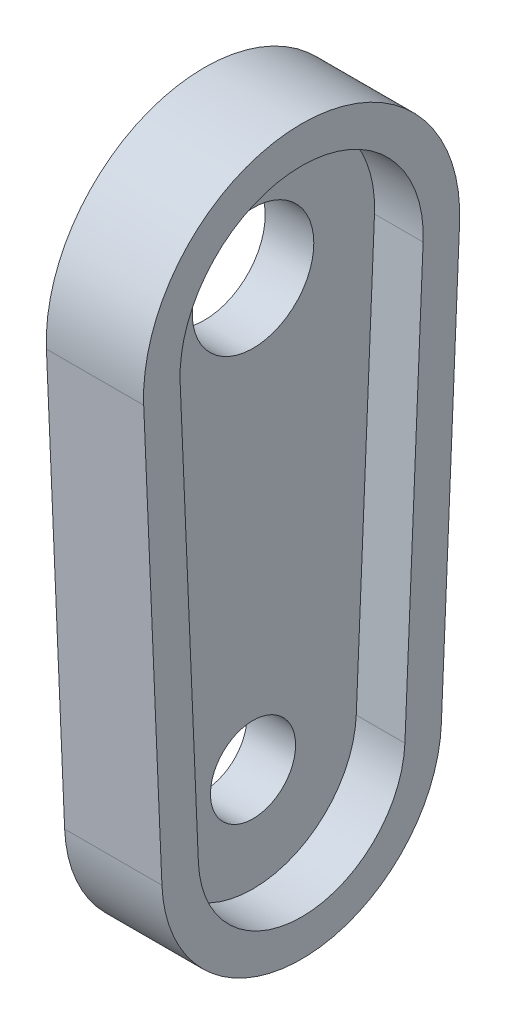
from build123d import *

# Parameters (mm, degrees)
EXTRUDE_1_DEPTH     = 4
EXTRUDE_2_DEPTH     = 8
CUT_EXTRUDE_1_DEPTH = 4


with BuildPart() as part:
    # Эскиз1 → Бобышка-Вытянуть1 (new body)
    with BuildSketch(Plane(origin=(0, 0, 0), x_dir=(0, 0, -1), z_dir=(1, 0, 0))):
        with BuildLine():
            Line((-7.553494652, -10.580393119), (-7.992649685, -0.342857143))
            ThreePointArc((-7.992649685, -0.342857143), (-0.171467962, 7.99816221), (8, 0))
            ThreePointArc((8, 0), (7.99816221, -0.171467962), (7.992649685, -0.342857143))
            Line((7.992649685, -0.342857143), (7.553494652, -10.580393119))
            ThreePointArc((7.553494652, -10.580393119), (11.428263628, -6.196352996), (12.988055737, -0.557142857))
            ThreePointArc((12.988055737, -0.557142857), (12.997013591, -0.278635438), (13, 0))
            ThreePointArc((13, 0), (-0.278635438, 12.997013591), (-12.988055737, -0.557142857))
            ThreePointArc((-12.988055737, -0.557142857), (-11.428263628, -6.196352996), (-7.553494652, -10.580393119))
        make_face()
        with BuildLine():
            Line((-4.727763281, -6.453545875), (-4.995406053, -0.214285714))
            ThreePointArc((-4.995406053, -0.214285714), (-0.107167476, 4.998851381), (5, 0))
            ThreePointArc((5, 0), (4.998851381, -0.107167476), (4.995406053, -0.214285714))
            Line((4.995406053, -0.214285714), (4.727763281, -6.453545875))
            ThreePointArc((4.727763281, -6.453545875), (7.056015568, -3.769966087), (7.992649685, -0.342857143))
            ThreePointArc((7.992649685, -0.342857143), (7.99816221, -0.171467962), (8, 0))
            ThreePointArc((8, 0), (-0.171467962, 7.99816221), (-7.992649685, -0.342857143))
            ThreePointArc((-7.992649685, -0.342857143), (-7.056015568, -3.769966087), (-4.727763281, -6.453545875))
        make_face()
        with BuildLine():
            Line((0, -8), (0, -5))
            ThreePointArc((0, -5), (-3.458942861, -3.610500559), (-4.995406053, -0.214285714))
            Line((-4.995406053, -0.214285714), (-4.727763281, -6.453545875))
            ThreePointArc((-4.727763281, -6.453545875), (-2.487130174, -7.603563868), (0, -8))
        make_face()
        with BuildLine():
            ThreePointArc((4.995406053, -0.214285714), (3.458942861, -3.610500559), (0, -5))
            Line((0, -5), (0, -8))
            ThreePointArc((0, -8), (2.487130174, -7.603563868), (4.727763281, -6.453545875))
            Line((4.727763281, -6.453545875), (4.995406053, -0.214285714))
        make_face()
        with BuildLine():
            ThreePointArc((4.727763281, -6.453545875), (2.487130174, -7.603563868), (0, -8))
            Line((0, -8), (0, -13))
            ThreePointArc((0, -13), (2.275699548, -12.799265274), (4.481120339, -12.203260241))
            Line((4.481120339, -12.203260241), (4.727763281, -6.453545875))
        make_face()
        with BuildLine():
            ThreePointArc((7.992649685, -0.342857143), (7.056015568, -3.769966087), (4.727763281, -6.453545875))
            Line((4.727763281, -6.453545875), (4.481120339, -12.203260241))
            ThreePointArc((4.481120339, -12.203260241), (6.071771893, -11.494937411), (7.553494652, -10.580393119))
            Line((7.553494652, -10.580393119), (7.992649685, -0.342857143))
        make_face()
        with BuildLine():
            Line((0, -13), (0, -8))
            ThreePointArc((0, -8), (-2.487130174, -7.603563868), (-4.727763281, -6.453545875))
            Line((-4.727763281, -6.453545875), (-4.481120339, -12.203260241))
            ThreePointArc((-4.481120339, -12.203260241), (-2.275699548, -12.799265274), (0, -13))
        make_face()
        with BuildLine():
            Line((-4.481120339, -12.203260241), (-4.727763281, -6.453545875))
            ThreePointArc((-4.727763281, -6.453545875), (-7.056015568, -3.769966087), (-7.992649685, -0.342857143))
            Line((-7.992649685, -0.342857143), (-7.553494652, -10.580393119))
            ThreePointArc((-7.553494652, -10.580393119), (-6.071771893, -11.494937411), (-4.481120339, -12.203260241))
        make_face()
        with BuildLine():
            Line((-3.966260715, -24.205613684), (-4.481120339, -12.203260241))
            ThreePointArc((-4.481120339, -12.203260241), (-6.071771893, -11.494937411), (-7.553494652, -10.580393119))
            Line((-7.553494652, -10.580393119), (-6.900606425, -25.80045485))
            ThreePointArc((-6.900606425, -25.80045485), (-5.491637274, -24.895945366), (-3.966260715, -24.205613684))
        make_face()
        with BuildLine():
            Line((-6.900606425, -25.80045485), (-7.553494652, -10.580393119))
            ThreePointArc((-7.553494652, -10.580393119), (-11.428263628, -6.196352996), (-12.988055737, -0.557142857))
            Line((-12.988055737, -0.557142857), (-11.489433922, -35.492857143))
            ThreePointArc((-11.489433922, -35.492857143), (-10.393943503, -30.07903074), (-6.900606425, -25.80045485))
        make_face()
        with BuildLine():
            Line((0, -23.5), (0, -13))
            ThreePointArc((0, -13), (-2.275699548, -12.799265274), (-4.481120339, -12.203260241))
            Line((-4.481120339, -12.203260241), (-3.966260715, -24.205613684))
            ThreePointArc((-3.966260715, -24.205613684), (-2.014268771, -23.677777545), (0, -23.5))
        make_face()
        with BuildLine():
            ThreePointArc((4.481120339, -12.203260241), (2.275699548, -12.799265274), (0, -13))
            Line((0, -13), (0, -23.5))
            ThreePointArc((0, -23.5), (2.014268771, -23.677777545), (3.966260715, -24.205613684))
            Line((3.966260715, -24.205613684), (4.481120339, -12.203260241))
        make_face()
        with BuildLine():
            ThreePointArc((7.553494652, -10.580393119), (6.071771893, -11.494937411), (4.481120339, -12.203260241))
            Line((4.481120339, -12.203260241), (3.966260715, -24.205613684))
            ThreePointArc((3.966260715, -24.205613684), (5.491637274, -24.895945366), (6.900606425, -25.80045485))
            Line((6.900606425, -25.80045485), (7.553494652, -10.580393119))
        make_face()
        with BuildLine():
            ThreePointArc((12.988055737, -0.557142857), (11.428263628, -6.196352996), (7.553494652, -10.580393119))
            Line((7.553494652, -10.580393119), (6.900606425, -25.80045485))
            ThreePointArc((6.900606425, -25.80045485), (10.286082196, -29.857382665), (11.5, -35))
            ThreePointArc((11.5, -35), (11.497358177, -35.246485195), (11.489433922, -35.492857143))
            Line((11.489433922, -35.492857143), (12.988055737, -0.557142857))
        make_face()
        with BuildLine():
            ThreePointArc((11.5, -35), (10.286082196, -29.857382665), (6.900606425, -25.80045485))
            Line((6.900606425, -25.80045485), (6.494027869, -35.278571429))
            ThreePointArc((6.494027869, -35.278571429), (0, -41.5), (-6.494027869, -35.278571429))
            Line((-6.494027869, -35.278571429), (-6.900606425, -25.80045485))
            ThreePointArc((-6.900606425, -25.80045485), (-10.393943503, -30.07903074), (-11.489433922, -35.492857143))
            ThreePointArc((-11.489433922, -35.492857143), (0, -46.5), (11.489433922, -35.492857143))
            ThreePointArc((11.489433922, -35.492857143), (11.497358177, -35.246485195), (11.5, -35))
        make_face()
        with BuildLine():
            ThreePointArc((6.5, -35), (5.766493566, -32.000408036), (3.731522476, -29.677806842))
            Line((3.731522476, -29.677806842), (3.496784237, -35.15))
            ThreePointArc((3.496784237, -35.15), (0, -38.5), (-3.496784237, -35.15))
            Line((-3.496784237, -35.15), (-3.731522476, -29.677806842))
            ThreePointArc((-3.731522476, -29.677806842), (-5.829460606, -32.124693225), (-6.494027869, -35.278571429))
            ThreePointArc((-6.494027869, -35.278571429), (0, -41.5), (6.494027869, -35.278571429))
            ThreePointArc((6.494027869, -35.278571429), (6.498506796, -35.139317719), (6.5, -35))
        make_face()
        with BuildLine():
            Line((-3.731522476, -29.677806842), (-3.966260715, -24.205613684))
            ThreePointArc((-3.966260715, -24.205613684), (-5.491637274, -24.895945366), (-6.900606425, -25.80045485))
            Line((-6.900606425, -25.80045485), (-6.494027869, -35.278571429))
            ThreePointArc((-6.494027869, -35.278571429), (-5.829460606, -32.124693225), (-3.731522476, -29.677806842))
        make_face()
        with BuildLine():
            Line((0, -28.5), (0, -23.5))
            ThreePointArc((0, -23.5), (-2.014268771, -23.677777545), (-3.966260715, -24.205613684))
            Line((-3.966260715, -24.205613684), (-3.731522476, -29.677806842))
            ThreePointArc((-3.731522476, -29.677806842), (-1.956494885, -28.801441477), (0, -28.5))
        make_face()
        with BuildLine():
            ThreePointArc((3.966260715, -24.205613684), (2.014268771, -23.677777545), (0, -23.5))
            Line((0, -23.5), (0, -28.5))
            ThreePointArc((0, -28.5), (1.956494885, -28.801441477), (3.731522476, -29.677806842))
            Line((3.731522476, -29.677806842), (3.966260715, -24.205613684))
        make_face()
        with BuildLine():
            Line((0, -31.5), (0, -28.5))
            ThreePointArc((0, -28.5), (-1.956494885, -28.801441477), (-3.731522476, -29.677806842))
            Line((-3.731522476, -29.677806842), (-3.496784237, -35.15))
            ThreePointArc((-3.496784237, -35.15), (-2.527350391, -32.578739997), (0, -31.5))
        make_face()
        with BuildLine():
            ThreePointArc((3.731522476, -29.677806842), (1.956494885, -28.801441477), (0, -28.5))
            Line((0, -28.5), (0, -31.5))
            ThreePointArc((0, -31.5), (2.474873734, -32.525126266), (3.5, -35))
            ThreePointArc((3.5, -35), (3.499195967, -35.075017233), (3.496784237, -35.15))
            Line((3.496784237, -35.15), (3.731522476, -29.677806842))
        make_face()
        with BuildLine():
            ThreePointArc((6.900606425, -25.80045485), (5.491637274, -24.895945366), (3.966260715, -24.205613684))
            Line((3.966260715, -24.205613684), (3.731522476, -29.677806842))
            ThreePointArc((3.731522476, -29.677806842), (5.766493566, -32.000408036), (6.5, -35))
            ThreePointArc((6.5, -35), (6.498506796, -35.139317719), (6.494027869, -35.278571429))
            Line((6.494027869, -35.278571429), (6.900606425, -25.80045485))
        make_face()
    extrude(amount=EXTRUDE_1_DEPTH)

    # Эскиз1<5> → Бобышка-Вытянуть2 (add)
    with BuildSketch(Plane(origin=(0, 0, 0), x_dir=(0, 0, -1), z_dir=(1, 0, 0))):
        with BuildLine():
            Line((-6.900606425, -25.80045485), (-7.553494652, -10.580393119))
            ThreePointArc((-7.553494652, -10.580393119), (-11.428263628, -6.196352996), (-12.988055737, -0.557142857))
            Line((-12.988055737, -0.557142857), (-11.489433922, -35.492857143))
            ThreePointArc((-11.489433922, -35.492857143), (-10.393943503, -30.07903074), (-6.900606425, -25.80045485))
        make_face()
        with BuildLine():
            Line((-6.494027869, -35.278571429), (-6.900606425, -25.80045485))
            ThreePointArc((-6.900606425, -25.80045485), (-10.393943503, -30.07903074), (-11.489433922, -35.492857143))
            ThreePointArc((-11.489433922, -35.492857143), (0, -46.5), (11.489433922, -35.492857143))
            ThreePointArc((11.489433922, -35.492857143), (11.497358177, -35.246485195), (11.5, -35))
            ThreePointArc((11.5, -35), (10.286082196, -29.857382665), (6.900606425, -25.80045485))
            Line((6.900606425, -25.80045485), (6.494027869, -35.278571429))
            ThreePointArc((6.494027869, -35.278571429), (0, -41.5), (-6.494027869, -35.278571429))
        make_face()
        with BuildLine():
            ThreePointArc((12.988055737, -0.557142857), (11.428263628, -6.196352996), (7.553494652, -10.580393119))
            Line((7.553494652, -10.580393119), (6.900606425, -25.80045485))
            ThreePointArc((6.900606425, -25.80045485), (10.286082196, -29.857382665), (11.5, -35))
            ThreePointArc((11.5, -35), (11.497358177, -35.246485195), (11.489433922, -35.492857143))
            Line((11.489433922, -35.492857143), (12.988055737, -0.557142857))
        make_face()
        with BuildLine():
            Line((-7.553494652, -10.580393119), (-7.992649685, -0.342857143))
            ThreePointArc((-7.992649685, -0.342857143), (-0.171467962, 7.99816221), (8, 0))
            ThreePointArc((8, 0), (7.99816221, -0.171467962), (7.992649685, -0.342857143))
            Line((7.992649685, -0.342857143), (7.553494652, -10.580393119))
            ThreePointArc((7.553494652, -10.580393119), (11.428263628, -6.196352996), (12.988055737, -0.557142857))
            ThreePointArc((12.988055737, -0.557142857), (12.997013591, -0.278635438), (13, 0))
            ThreePointArc((13, 0), (-0.278635438, 12.997013591), (-12.988055737, -0.557142857))
            ThreePointArc((-12.988055737, -0.557142857), (-11.428263628, -6.196352996), (-7.553494652, -10.580393119))
        make_face()
    extrude(amount=EXTRUDE_2_DEPTH)

    # Эскиз2 → Вырез-Вытянуть1 (cut)
    with BuildSketch(Plane(origin=(8, 0, 0), x_dir=(0, 0, -1), z_dir=(1, 0, 0))):
        with BuildLine():
            Line((-9.990812106, -0.428571429), (-8.49219029, -35.364285714))
            ThreePointArc((-8.49219029, -35.364285714), (0, -43.5), (8.49219029, -35.364285714))
            Line((8.49219029, -35.364285714), (9.990812106, -0.428571429))
            ThreePointArc((9.990812106, -0.428571429), (0, 10), (-9.990812106, -0.428571429))
        make_face()
    extrude(amount=-CUT_EXTRUDE_1_DEPTH, mode=Mode.SUBTRACT)


solid = part.part
